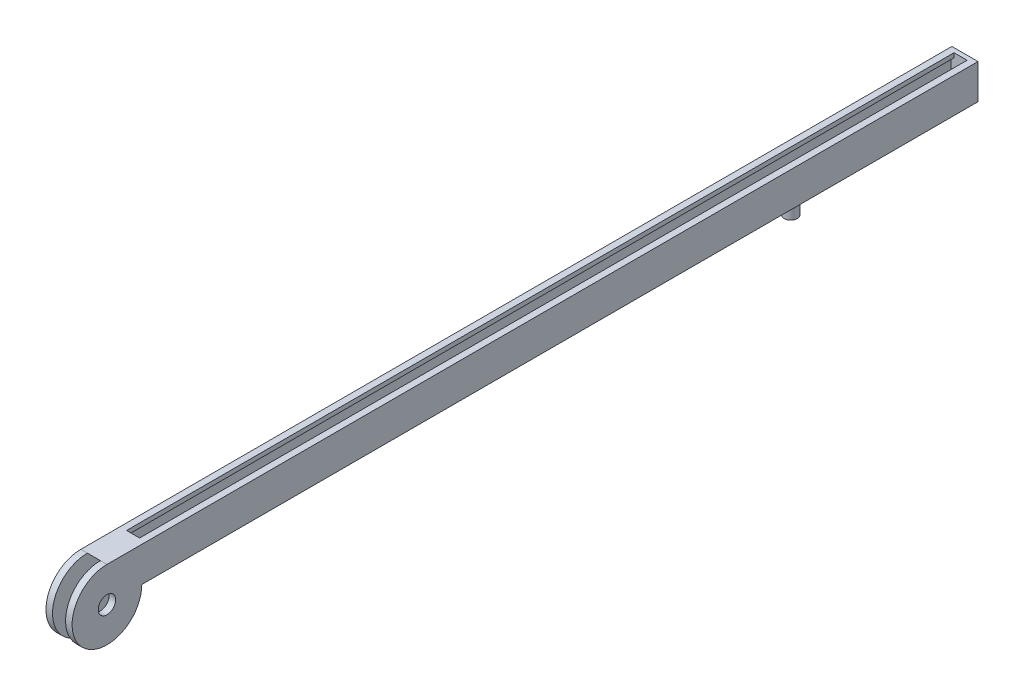
from build123d import *

# Parameters (mm, degrees)
SKETCH1_W           = 60
SKETCH1_H           = 2000
BOSS_EXTRUDE1_DEPTH = 80
CUT_EXTRUDE1_START  = -90
CUT_EXTRUDE1_DEPTH  = 1900
SKETCH3_R           = 80
BOSS_EXTRUDE2_DEPTH = 60
CUT_EXTRUDE2_START  = -15
SKETCH3_2_R         = 80
CUT_EXTRUDE2_DEPTH  = 30
CUT_EXTRUDE3_REACH  = 2004.498
SKETCH4_R           = 20
SKETCH5_R           = 15
SKETCH5_R_2         = 7.5
BOSS_EXTRUDE3_DEPTH = 40
CUT_EXTRUDE4_START  = -15
SKETCH6_R           = 10.5
CUT_EXTRUDE4_DEPTH  = 2


with BuildPart() as part:
    # Sketch1 → Boss-Extrude1 (new body)
    with BuildSketch(Plane(origin=(0, 0, 0), x_dir=(1, 0, 0), z_dir=(0, 1, 0))):
        with Locations((30, 1000)):
            Rectangle(SKETCH1_W, SKETCH1_H)
    extrude(amount=BOSS_EXTRUDE1_DEPTH)

    # Sketch2 → Cut-Extrude1 (cut)
    with BuildSketch(Plane.XY.offset(CUT_EXTRUDE1_START)):
        Polygon((15, 80), (15, 70), (8, 70), (8, 10), (52, 10), (52, 70), (45, 70), (45, 80), align=None)
    extrude(amount=-CUT_EXTRUDE1_DEPTH, mode=Mode.SUBTRACT)

    # Sketch3 → Boss-Extrude2 (add)
    with BuildSketch(Plane(origin=(60, 0, 0), x_dir=(0, 0, -1), z_dir=(1, 0, 0))):
        Circle(SKETCH3_R)
    extrude(amount=-BOSS_EXTRUDE2_DEPTH)

    # Sketch3<2> → Cut-Extrude2 (cut)
    with BuildSketch(Plane(origin=(60, 0, 0), x_dir=(0, 0, -1), z_dir=(1, 0, 0)).offset(CUT_EXTRUDE2_START)):
        Circle(SKETCH3_2_R)
    extrude(amount=-CUT_EXTRUDE2_DEPTH, mode=Mode.SUBTRACT)

    # Cut-Extrude3: up to this face of the body (flat: up to its plane)
    cut_extrude3_end = Plane(part.part.faces().sort_by_distance((0, 35.579997564, -912.895006003))[0])
    # Sketch4 → Cut-Extrude3 (cut, up to the picked face)
    with BuildSketch(Plane(origin=(60, 0, 0), x_dir=(0, 0, -1), z_dir=(1, 0, 0)), mode=Mode.PRIVATE) as cut_extrude3_sk1:
        Circle(SKETCH4_R)
    cut_extrude3_tool1 = split(extrude(cut_extrude3_sk1.sketch, amount=-CUT_EXTRUDE3_REACH, mode=Mode.PRIVATE), bisect_by=cut_extrude3_end, keep=Keep.BOTH, mode=Mode.PRIVATE)
    add(cut_extrude3_tool1.solids().sort_by(Axis((60, 0, 0), (-1, 0, 0)))[0], mode=Mode.SUBTRACT)

    # Sketch5 → Boss-Extrude3 (add)
    with BuildSketch(Plane.XZ):
        with Locations(Location((30, -1600, 0), (0, 0, 90))):
            Circle(SKETCH5_R)
        with Locations(Location((30, -1600, 0), (0, 0, 270))):
            Circle(SKETCH5_R_2, mode=Mode.SUBTRACT)
    extrude(amount=BOSS_EXTRUDE3_DEPTH)

    # Sketch6 → Cut-Extrude4 (cut)
    with BuildSketch(Plane.XZ.offset(40).offset(CUT_EXTRUDE4_START)):
        with Locations(Location((30, -1600, 0), (0, 0, 270))):
            Circle(SKETCH6_R)
    extrude(amount=-CUT_EXTRUDE4_DEPTH, mode=Mode.SUBTRACT)


solid = part.part
